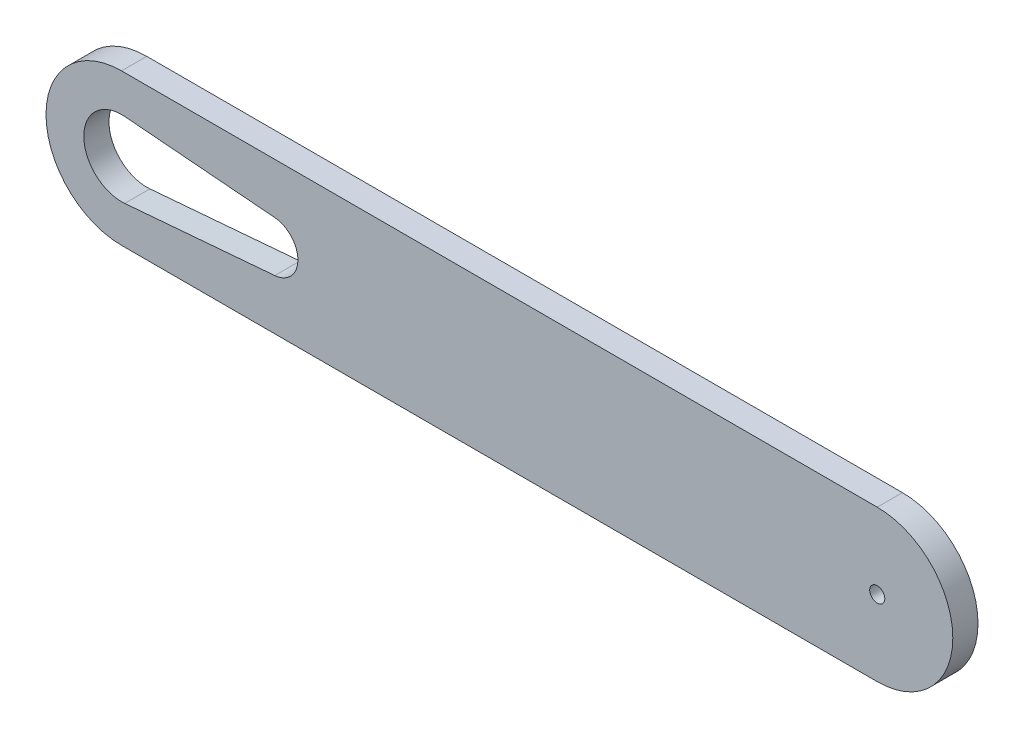
from build123d import *

# Parameters (mm, degrees)
BOSS_EXTRUDE1_DEPTH = 5
SKETCH4_R           = 1.5
CUT_EXTRUDE1_DEPTH  = 5


with BuildPart() as part:
    # Sketch2 → Boss-Extrude1 (new body)
    with BuildSketch(Plane.XY):
        with BuildLine():
            Line((-75, 15), (75, 15))
            ThreePointArc((75, 15), (90, 0), (75, -15))
            Line((75, -15), (-75, -15))
            ThreePointArc((-75, -15), (-90, 0), (-75, 15))
        make_face()
    extrude(amount=BOSS_EXTRUDE1_DEPTH)

    # Sketch4 → Cut-Extrude1 (cut)
    with BuildSketch(Plane(origin=(0, 0, 0), x_dir=(-1, 0, 0), z_dir=(0, 0, -1))):
        with Locations((-75, 0)):
            Circle(SKETCH4_R)
        with BuildLine():
            Line((44.583333333, 4.982608643), (74.375, 7.473912964))
            ThreePointArc((74.375, 7.473912964), (82.5, 0), (74.375, -7.473912964))
            Line((74.375, -7.473912964), (44.583333333, -4.982608643))
            ThreePointArc((44.583333333, -4.982608643), (40, 0), (44.583333333, 4.982608643))
        make_face()
    extrude(amount=-CUT_EXTRUDE1_DEPTH, mode=Mode.SUBTRACT)


solid = part.part
